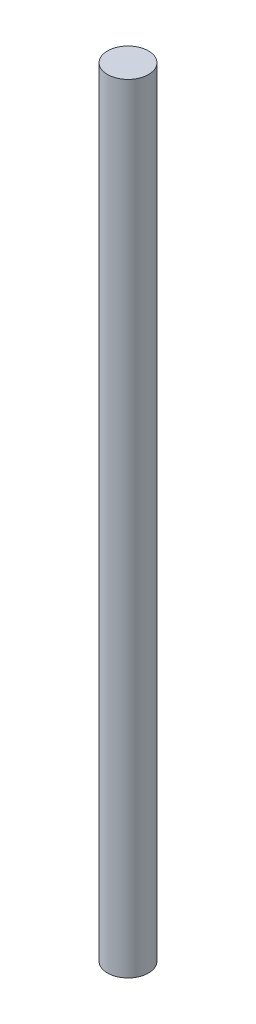
from build123d import *

# Parameters (mm, degrees)
SKETCH1_R           = 3.175
BOSS_EXTRUDE1_DEPTH = 120.65


with BuildPart() as part:
    # Sketch1 → Boss-Extrude1 (new body)
    with BuildSketch(Plane(origin=(0, 0, 0), x_dir=(1, 0, 0), z_dir=(0, 1, 0))):
        with Locations(Location((0, 0, 0), (0, 0, 90))):
            Circle(SKETCH1_R)
    extrude(amount=BOSS_EXTRUDE1_DEPTH)


solid = part.part
